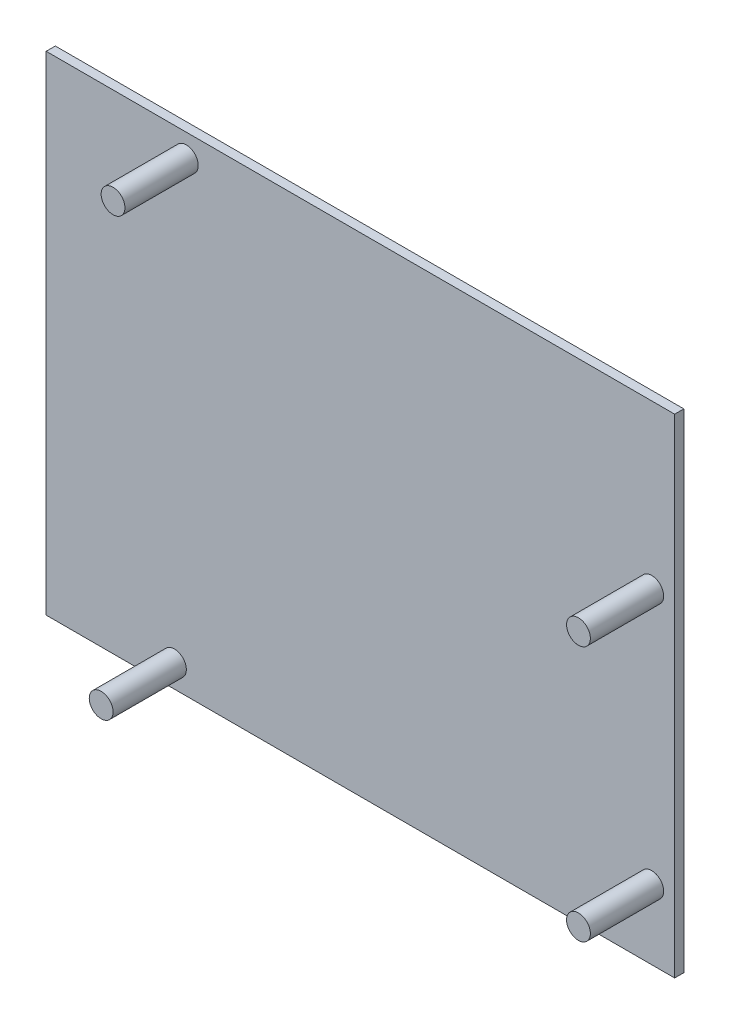
from build123d import *

# Parameters (mm, degrees)
SKETCH1_W           = 68.6
SKETCH1_H           = 53.3
BOSS_EXTRUDE1_DEPTH = 1
SKETCH2_R           = 1.3
BOSS_EXTRUDE2_DEPTH = 8


with BuildPart() as part:
    # Sketch1 → Boss-Extrude1 (new body)
    with BuildSketch(Plane.XY):
        with Locations((34.3, 26.65)):
            Rectangle(SKETCH1_W, SKETCH1_H)
    extrude(amount=BOSS_EXTRUDE1_DEPTH)

    # Sketch2 → Boss-Extrude2 (add)
    with BuildSketch(Plane.XY.offset(1)):
        with Locations(Location((14, 2.5, 0), (0, 0, 180))):
            Circle(SKETCH2_R)
        with Locations(Location((15.3, 50.8, 0), (0, 0, 180))):
            Circle(SKETCH2_R)
        with Locations(Location((66.1, 7.6, 0), (0, 0, 180))):
            Circle(SKETCH2_R)
        with Locations(Location((66.1, 35.5, 0), (0, 0, 180))):
            Circle(SKETCH2_R)
    extrude(amount=BOSS_EXTRUDE2_DEPTH)


solid = part.part
